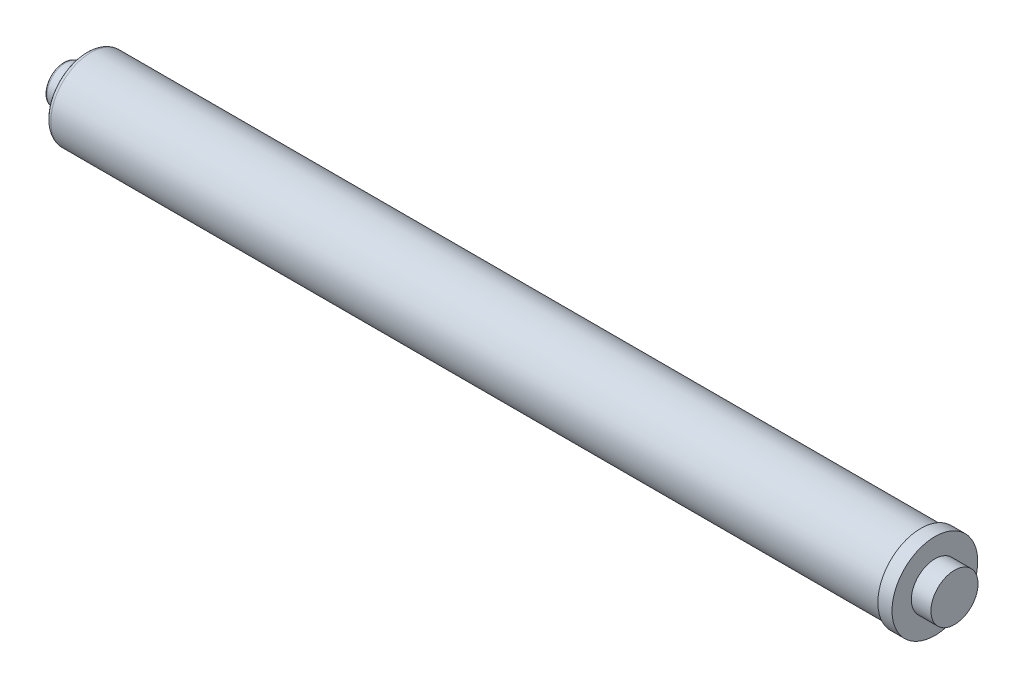
from build123d import *

# Parameters (mm, degrees)
SKETCH1_W = 13.208
SKETCH1_H = 15.875


with BuildPart() as part:
    # Sketch1 → Revolve1 (revolve)
    with BuildSketch(Plane(origin=(0, 0, 0), x_dir=(1, 0, 0), z_dir=(0, 1, 0)), mode=Mode.PRIVATE) as revolve1_sk:
        with BuildLine():
            Line((-281.178, 12.7), (-281.178, 0))
            Line((-281.178, 0), (281.178, 0))
            Line((281.178, 0), (281.178, 26.9875))
            Line((281.178, 26.9875), (-278.003, 26.9875))
            ThreePointArc((-278.003, 26.9875), (-280.24806403, 26.05756403), (-281.178, 23.8125))
            Line((-281.178, 23.8125), (-281.178, 12.7))
        make_face()
        with BuildLine():
            Line((-296.418, 11.1125), (-296.418, 0))
            Line((-296.418, 0), (-281.178, 0))
            Line((-281.178, 0), (-281.178, 12.7))
            Line((-281.178, 12.7), (-294.8305, 12.7))
            ThreePointArc((-294.8305, 12.7), (-295.953032015, 12.235032015), (-296.418, 11.1125))
        make_face()
        Polygon((281.178, 26.9875), (281.178, 0), (290.703, 0), (290.703, 15.875), (290.703, 28.8925), (281.178, 28.8925), align=None)
        with Locations((297.307, 7.9375)):
            Rectangle(SKETCH1_W, SKETCH1_H)
    revolve(revolve1_sk.sketch.rotate(Axis((-319.562207996, 0, 0), (1, 0, 0)), 180), axis=Axis((-319.562207996, 0, 0), (1, 0, 0)))


solid = part.part
